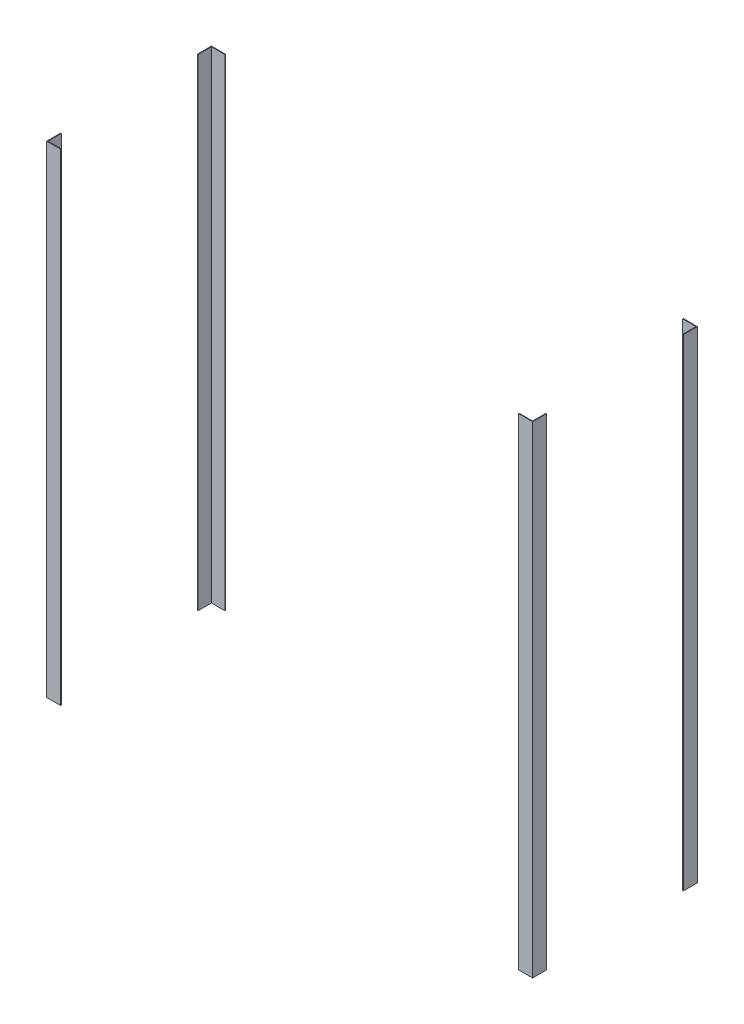
from build123d import *

# Parameters (mm, degrees)
BOSS_EXTRUDE1_DEPTH   = 1828.8
BOSS_EXTRUDE1_2_DEPTH = 1828.8
BOSS_EXTRUDE1_3_DEPTH = 1828.8
BOSS_EXTRUDE1_4_DEPTH = 1828.8


with BuildPart() as part:
    # Sketch1 → Boss-Extrude1 (new body)
    with BuildSketch(Plane(origin=(0, 0, 0), x_dir=(1, 0, 0), z_dir=(0, 1, 0))):
        Polygon((-922.3375, -312.7375), (-869.15625, -312.7375), (-869.15625, -310.35625), (-919.95625, -310.35625), (-919.95625, -259.55625), (-922.3375, -259.55625), align=None)
    extrude(amount=BOSS_EXTRUDE1_DEPTH)


with BuildPart() as body_2:
    # Sketch1 → Boss-Extrude1 2 (new body)
    with BuildSketch(Plane(origin=(0, 0, 0), x_dir=(1, 0, 0), z_dir=(0, 1, 0))):
        Polygon((-922.3375, 312.7375), (-869.15625, 312.7375), (-869.15625, 310.35625), (-919.95625, 310.35625), (-919.95625, 259.55625), (-922.3375, 259.55625), align=None)
    extrude(amount=BOSS_EXTRUDE1_2_DEPTH)


with BuildPart() as body_3:
    # Sketch1 → Boss-Extrude1 3 (new body)
    with BuildSketch(Plane(origin=(0, 0, 0), x_dir=(1, 0, 0), z_dir=(0, 1, 0))):
        Polygon((922.3375, -312.7375), (922.3375, -259.55625), (919.95625, -259.55625), (919.95625, -310.35625), (869.15625, -310.35625), (869.15625, -312.7375), align=None)
    extrude(amount=BOSS_EXTRUDE1_3_DEPTH)


with BuildPart() as body_4:
    # Sketch1 → Boss-Extrude1 4 (new body)
    with BuildSketch(Plane(origin=(0, 0, 0), x_dir=(1, 0, 0), z_dir=(0, 1, 0))):
        Polygon((869.15625, 312.7375), (869.15625, 310.35625), (919.95625, 310.35625), (919.95625, 259.55625), (922.3375, 259.55625), (922.3375, 312.7375), align=None)
    extrude(amount=BOSS_EXTRUDE1_4_DEPTH)


solid = Compound([part.part, body_2.part, body_3.part, body_4.part])
